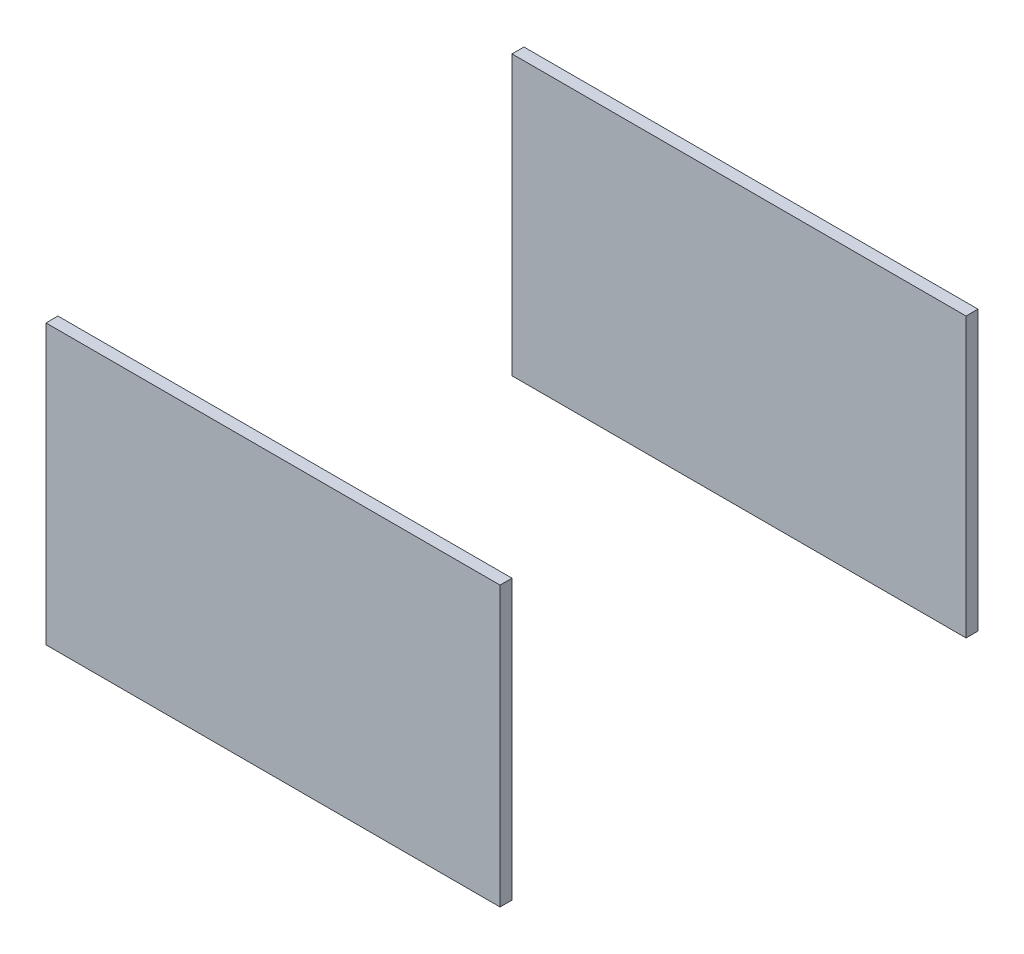
from build123d import *

# Parameters (mm, degrees)
SKETCH1_W           = 140
SKETCH1_H           = 160
BOSS_EXTRUDE1_DEPTH = 3
SKETCH2_W           = 120
SKETCH2_H           = 120
SKETCH2_W_2         = 114
SKETCH2_H_2         = 114
BOSS_EXTRUDE2_DEPTH = 70
SKETCH4_W           = 120
SKETCH4_H           = 120
BOSS_EXTRUDE4_DEPTH = 3
SKETCH5_R           = 2.1
SKETCH5_W           = 39.9
SKETCH5_H           = 19.71
CUT_EXTRUDE2_DEPTH  = 3
SKETCH6_W           = 18.298163042
SKETCH6_H           = 17.309993256
CUT_EXTRUDE3_DEPTH  = 3
CUT_EXTRUDE8_DEPTH  = 5
SKETCH15_W          = 259.021634325
SKETCH15_H          = 180.269434884
BOSS_EXTRUDE5_DEPTH = 3
SKETCH18_R          = 1.6
CUT_EXTRUDE9_DEPTH  = 10
SKETCH19_W          = 12
SKETCH19_H          = 4.5
SKETCH19_H_2        = 8.4
SKETCH19_W_2        = 10.084057066
SKETCH19_H_3        = 7.362028533
CUT_EXTRUDE11_DEPTH = 5
SKETCH20_W          = 263.921538054
SKETCH20_H          = 19.630552878
SKETCH20_W_2        = 120
SKETCH20_H_2        = 3
CUT_EXTRUDE12_DEPTH = 233.259150239
SKETCH21_W          = 259.021634325
SKETCH21_H          = 40.269434884
CUT_EXTRUDE13_DEPTH = 209.619923406
SKETCH22_W          = 3
SKETCH22_H          = 120
SKETCH22_H_2        = 122.072039114
CUT_EXTRUDE14_DEPTH = 111


with BuildPart() as part:
    # Sketch1 → Boss-Extrude1 (new body)
    with BuildSketch(Plane(origin=(0, 0, 0), x_dir=(1, 0, 0), z_dir=(0, 1, 0))):
        Rectangle(SKETCH1_W, SKETCH1_H)
    extrude(amount=BOSS_EXTRUDE1_DEPTH)

    # Sketch2 → Boss-Extrude2 (add)
    with BuildSketch(Plane(origin=(0, 3, 0), x_dir=(1, 0, 0), z_dir=(0, 1, 0))):
        Rectangle(SKETCH2_W, SKETCH2_H)
        Rectangle(SKETCH2_W_2, SKETCH2_H_2, mode=Mode.SUBTRACT)
    extrude(amount=BOSS_EXTRUDE2_DEPTH)

    # Sketch4 → Boss-Extrude4 (add)
    with BuildSketch(Plane(origin=(0, 73, 0), x_dir=(1, 0, 0), z_dir=(0, 1, 0))):
        Rectangle(SKETCH4_W, SKETCH4_H)
    extrude(amount=BOSS_EXTRUDE4_DEPTH)

    # Sketch5 → Cut-Extrude2 (cut)
    with BuildSketch(Plane(origin=(0, 76, 0), x_dir=(1, 0, 0), z_dir=(0, 1, 0))):
        with Locations(Location((34.39, -4.925, 0), (0, 0, 270))):
            Circle(SKETCH5_R)
        with Locations(Location((34.39, 4.925, 0), (0, 0, 270))):
            Circle(SKETCH5_R)
        with Locations(Location((-15.03, -4.925, 0), (0, 0, 270))):
            Circle(SKETCH5_R)
        with Locations(Location((-15.03, 4.925, 0), (0, 0, 270))):
            Circle(SKETCH5_R)
        with Locations((9.68, 0)):
            Rectangle(SKETCH5_W, SKETCH5_H)
    extrude(amount=-CUT_EXTRUDE2_DEPTH, mode=Mode.SUBTRACT)

    # Sketch6 → Cut-Extrude3 (cut)
    with BuildSketch(Plane(origin=(0, 76, 0), x_dir=(1, 0, 0), z_dir=(0, 1, 0))):
        Rectangle(SKETCH6_W, SKETCH6_H)
    extrude(amount=-CUT_EXTRUDE3_DEPTH, mode=Mode.SUBTRACT)

    # Sketch13 → Cut-Extrude8 (cut)
    with BuildSketch(Plane(origin=(0, 76, 0), x_dir=(1, 0, 0), z_dir=(0, 1, 0))):
        with BuildLine():
            ThreePointArc((-3.792582359, 49.728765052), (-53.491503795, -1.722579942), (-0.349490011, -49.609426409))
            ThreePointArc((-0.349490011, -49.609426409), (5.82592347, -42.51288634), (-1.270616599, -36.337472859))
            ThreePointArc((-1.270616599, -36.337472859), (-40.195607742, -1.261740085), (-3.792582359, 36.42488497))
            ThreePointArc((-3.792582359, 36.42488497), (2.859357682, 43.076825011), (-3.792582359, 49.728765052))
        make_face()
    extrude(amount=-CUT_EXTRUDE8_DEPTH, mode=Mode.SUBTRACT)

    # Sketch15 → Boss-Extrude5 (add)
    with BuildSketch(Plane(origin=(0, 3, 0), x_dir=(1, 0, 0), z_dir=(0, 1, 0))):
        with Locations((-39.510817163, -10.134717442)):
            Rectangle(SKETCH15_W, SKETCH15_H)
    extrude(amount=-BOSS_EXTRUDE5_DEPTH)

    # Sketch18 → Cut-Extrude9 (cut)
    with BuildSketch(Plane(origin=(0, 3, 0), x_dir=(1, 0, 0), z_dir=(0, 1, 0))):
        with Locations(Location((-55.452, -27.227420358, 0), (0, 0, 194.647469308))):
            Circle(SKETCH18_R)
        with Locations(Location((-55.452, 32.208579642, 0), (0, 0, 194.647469308))):
            Circle(SKETCH18_R)
        with Locations(Location((4.746, 32.208579642, 0), (0, 0, 270))):
            Circle(SKETCH18_R)
        with Locations(Location((4.746, -27.227420358, 0), (0, 0, 270))):
            Circle(SKETCH18_R)
    extrude(amount=-CUT_EXTRUDE9_DEPTH, mode=Mode.SUBTRACT)

    # Sketch19 → Cut-Extrude11 (cut)
    with BuildSketch(Plane.ZY.offset(60)):
        with Locations((12.367420358, 33)):
            Rectangle(SKETCH19_W, SKETCH19_H)
        with Locations((-11.259414931, 37.2)):
            Rectangle(SKETCH19_W, SKETCH19_H_2)
        with Locations((-28.606781654, 36.742945388)):
            Rectangle(SKETCH19_W_2, SKETCH19_H_3)
    extrude(amount=-CUT_EXTRUDE11_DEPTH, mode=Mode.SUBTRACT)

    # Sketch20 → Cut-Extrude12 (cut, through all)
    with BuildSketch(Plane.XY.offset(60)):
        with Locations((-37.060865298, -6.815276439)):
            Rectangle(SKETCH20_W, SKETCH20_H)
        with Locations((0, 74.5)):
            Rectangle(SKETCH20_W_2, SKETCH20_H_2)
    extrude(amount=-CUT_EXTRUDE12_DEPTH, mode=Mode.SUBTRACT)


with BuildPart() as cut_extrude12_piece_1:
    # of the separate pieces the step leaves, piece 1, a body of its own (cut_extrude12_pieces)
    add(part.part.solids().sort_by_distance((60, 73, 60))[0])

    # Sketch22 → Cut-Extrude14 (cut, through all)
    with BuildSketch(Plane(origin=(0, 73, 0), x_dir=(1, 0, 0), z_dir=(0, 1, 0))):
        with Locations((-58.5, 0)):
            Rectangle(SKETCH22_W, SKETCH22_H)
        with Locations((58.5, -1.036019557)):
            Rectangle(SKETCH22_W, SKETCH22_H_2)
    extrude(amount=-CUT_EXTRUDE14_DEPTH, mode=Mode.SUBTRACT)


with BuildPart() as cut_extrude12_piece_2:
    # of the separate pieces the step leaves, piece 2, a body of its own (cut_extrude12_pieces)
    add(part.part.solids().sort_by_distance((90, 0, 60))[0])

    # Sketch21 → Cut-Extrude13 (cut, through all)
    with BuildSketch(Plane(origin=(0, 3, 0), x_dir=(1, 0, 0), z_dir=(0, 1, 0))):
        with Locations((-39.510817163, -80.134717442)):
            Rectangle(SKETCH21_W, SKETCH21_H)
    extrude(amount=-CUT_EXTRUDE13_DEPTH, mode=Mode.SUBTRACT)


with BuildPart() as cut_extrude14_piece_1:
    # of the separate pieces the step leaves, piece 1, a body of its own (cut_extrude14_pieces)
    add(cut_extrude12_piece_1.part.solids().sort_by_distance((57, 3, -57))[0])


with BuildPart() as cut_extrude14_piece_2:
    # of the separate pieces the step leaves, piece 2, a body of its own (cut_extrude14_pieces)
    add(cut_extrude12_piece_1.part.solids().sort_by_distance((57, 73, 60))[0])


solid = Compound([cut_extrude14_piece_1.part, cut_extrude14_piece_2.part])
